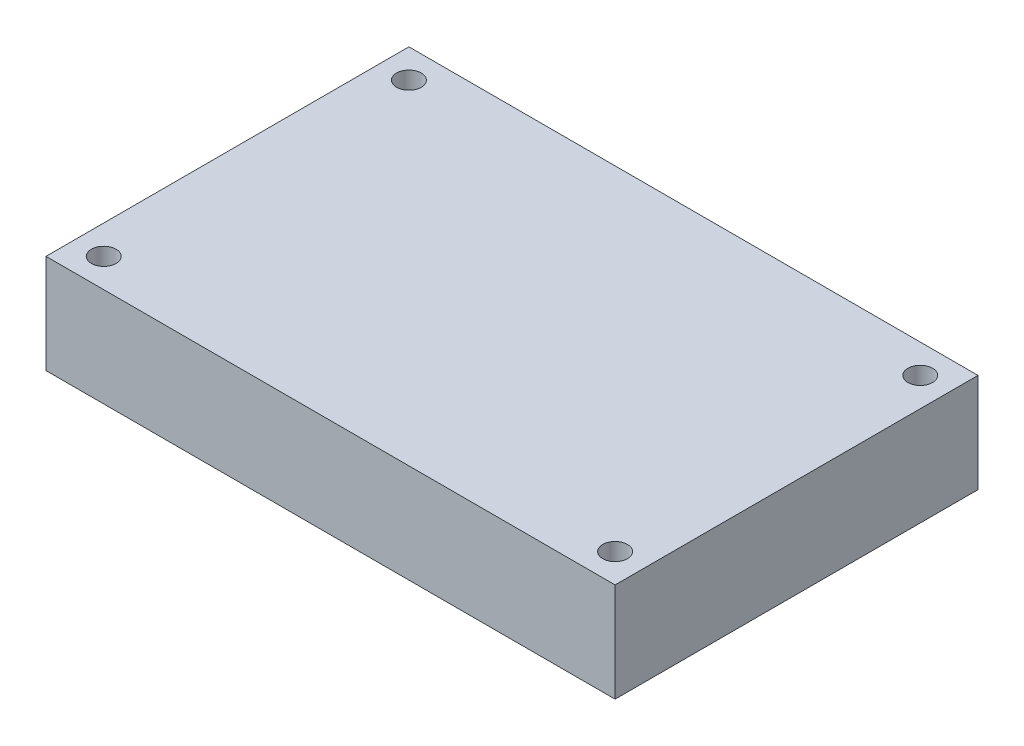
from build123d import *

# Parameters (mm, degrees)
SKETCH_1_W          = 69
SKETCH_1_H          = 44
EXTRUDE_1_DEPTH     = 12
SKETCH_2_R          = 1.5
CUT_EXTRUDE_1_DEPTH = 43.640942766


with BuildPart() as part:
    # 草图1 → 凸台-拉伸1 (new body)
    with BuildSketch(Plane(origin=(0, 0, 0), x_dir=(1, 0, 0), z_dir=(0, 1, 0))):
        Rectangle(SKETCH_1_W, SKETCH_1_H)
    extrude(amount=EXTRUDE_1_DEPTH)

    # 草图2 → 切除-拉伸1 (cut, through all)
    with BuildSketch(Plane(origin=(0, 12, 0), x_dir=(1, 0, 0), z_dir=(0, 1, 0))):
        with Locations(Location((-31, 18.5, 0), (0, 0, 270))):
            Circle(SKETCH_2_R)
        with Locations(Location((-31, -18.5, 0), (0, 0, 90))):
            Circle(SKETCH_2_R)
        with Locations(Location((31, -18.5, 0), (0, 0, 270))):
            Circle(SKETCH_2_R)
        with Locations(Location((31, 18.5, 0), (0, 0, 90))):
            Circle(SKETCH_2_R)
    extrude(amount=-CUT_EXTRUDE_1_DEPTH, mode=Mode.SUBTRACT)


solid = part.part
